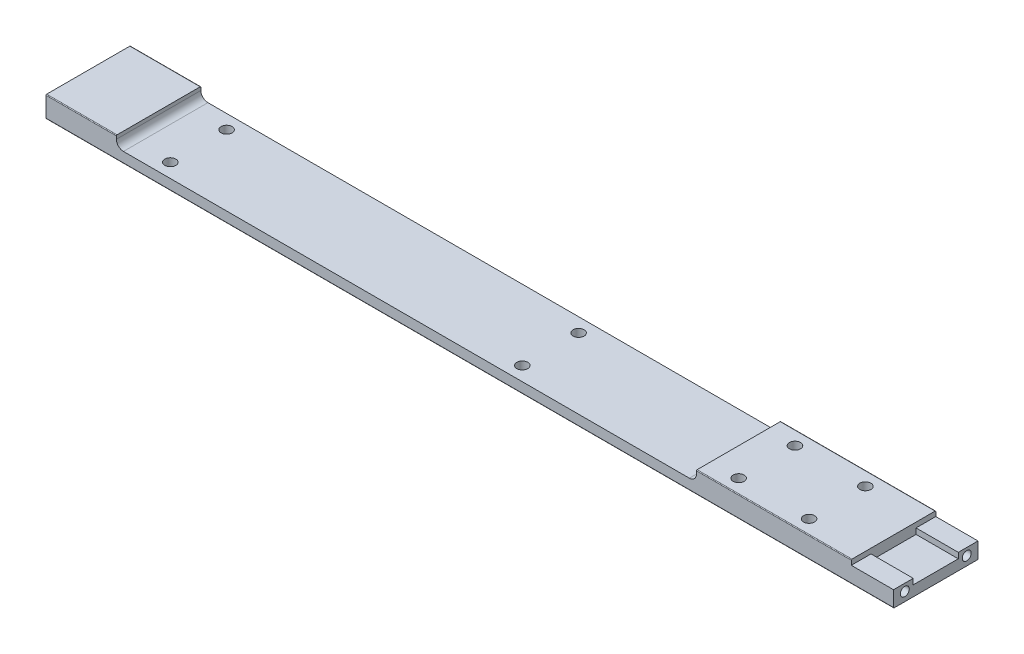
from build123d import *

# Parameters (mm, degrees)
BOSS_EXTRUDE1_DEPTH              = 4.7625
BOSS_EXTRUDE1_DEPTH_BACK         = 4.7625
SKETCH3_W                        = 382.27
SKETCH3_H                        = 38.1
FILLET1_R                        = 0.314325
TAP_DRILL_FOR_10_32_TAP1_D       = 4.0386
TAP_DRILL_FOR_10_32_TAP1_DEPTH   = 25.4
TAP_DRILL_FOR_10_32_TAP1_TIP     = 1.213317848
TAP_DRILL_FOR_10_32_TAP2_D       = 4.0386
TAP_DRILL_FOR_10_32_TAP2_DEPTH   = 25.4
TAP_DRILL_FOR_10_32_TAP2_TIP     = 1.213317848
SKETCH10_W                       = 19.05
SKETCH10_H                       = 2.286
CUT_EXTRUDE1_DEPTH               = 195.953531979
F_10_CLEARANCE_HOLE1_D           = 4.9784
F_10_CLEARANCE_HOLE1_CSINK_D     = 10.4394
F_10_CLEARANCE_HOLE1_CSINK_ANGLE = 82
CUT_EXTRUDE2_DEPTH               = 2.54
F_10_CLEARANCE_HOLE2_D           = 4.9784


with BuildPart() as part:
    # Sketch3 → Boss-Extrude1 (new, two sides: drawn at the far end of the back side and taken through both)
    with BuildSketch(Plane(origin=(0, 0, 0), x_dir=(1, 0, 0), z_dir=(0, 1, 0)).offset(-BOSS_EXTRUDE1_DEPTH_BACK)):
        Rectangle(SKETCH3_W, SKETCH3_H)
    extrude(amount=BOSS_EXTRUDE1_DEPTH + BOSS_EXTRUDE1_DEPTH_BACK)

    # Fillet1
    fillet1_edges = [part.edges().sort_by_distance(p)[0] for p in [
        (0, 4.7625, 19.05),
        (0, -4.7625, -19.05),
        (0, 4.7625, -19.05),
        (0, -4.7625, 19.05),
    ]]
    fillet(fillet1_edges, radius=FILLET1_R)

    # Tap Drill for #10-32 Tap1
    with Locations(Plane.ZY.offset(191.135)):
        with Locations((-13.97, -0.762), (13.97, -0.762)):
            Hole(TAP_DRILL_FOR_10_32_TAP1_D / 2, depth=TAP_DRILL_FOR_10_32_TAP1_DEPTH)
            with Locations((0, 0, -(TAP_DRILL_FOR_10_32_TAP1_DEPTH + TAP_DRILL_FOR_10_32_TAP1_TIP / 2))):  # 118° drill point
                Cone(0, TAP_DRILL_FOR_10_32_TAP1_D / 2, TAP_DRILL_FOR_10_32_TAP1_TIP, mode=Mode.SUBTRACT)

    # Tap Drill for #10-32 Tap2
    with Locations(Plane(origin=(191.135, 0, 0), x_dir=(0, 0, -1), z_dir=(1, 0, 0))):
        with Locations((-13.97, -0.762), (13.97, -0.762)):
            Hole(TAP_DRILL_FOR_10_32_TAP2_D / 2, depth=TAP_DRILL_FOR_10_32_TAP2_DEPTH)
            with Locations((0, 0, -(TAP_DRILL_FOR_10_32_TAP2_DEPTH + TAP_DRILL_FOR_10_32_TAP2_TIP / 2))):  # 118° drill point
                Cone(0, TAP_DRILL_FOR_10_32_TAP2_D / 2, TAP_DRILL_FOR_10_32_TAP2_TIP, mode=Mode.SUBTRACT)

    # Sketch10 → Cut-Extrude1 (cut, through all)
    with BuildSketch(Plane(origin=(0, 0, -19.05), x_dir=(-1, 0, 0), z_dir=(0, 0, -1))):
        with BuildLine():
            Line((159.385, 4.7625), (159.385, 3.175))
            ThreePointArc((159.385, 3.175), (158.45506403, 0.92993597), (156.21, 0))
            Line((156.21, 0), (-99.06, 0))
            ThreePointArc((-99.06, 0), (-101.30506403, 0.92993597), (-102.235, 3.175))
            Line((-102.235, 3.175), (-102.235, 4.7625))
            Line((-102.235, 4.7625), (159.385, 4.7625))
        make_face()
        with Locations((-181.61, 3.6195)):
            Rectangle(SKETCH10_W, SKETCH10_H)
    extrude(amount=-CUT_EXTRUDE1_DEPTH, mode=Mode.SUBTRACT)

    # #10 Clearance Hole1 (through all)
    with Locations(Plane(origin=(0, -4.7625, 0), x_dir=(-1, 0, 0), z_dir=(0, -1, 0))):
        with Locations((-114.935, 12.7), (-146.685, 12.7), (-146.685, -12.7), (-114.935, -12.7)):
            CounterSinkHole(F_10_CLEARANCE_HOLE1_D / 2, F_10_CLEARANCE_HOLE1_CSINK_D / 2, counter_sink_angle=F_10_CLEARANCE_HOLE1_CSINK_ANGLE)

    # Sketch17 → Cut-Extrude2 (cut)
    with BuildSketch(Plane(origin=(0, 2.4765, 0), x_dir=(1, 0, 0), z_dir=(0, 1, 0))):
        Polygon((191.135, 0), (191.135, 10.16), (172.085, 10.16), (172.085, -10.16), (191.135, -10.16), align=None)
    extrude(amount=-CUT_EXTRUDE2_DEPTH, mode=Mode.SUBTRACT)

    # #10 Clearance Hole2 (through all)
    with Locations(Plane(origin=(0, 0, 0), x_dir=(1, 0, 0), z_dir=(0, 1, 0))):
        with Locations((-141.418780002, 12.7), (-141.418780002, -12.7), (17.331219998, 12.7), (17.331219998, -12.7)):
            Hole(F_10_CLEARANCE_HOLE2_D / 2)


solid = part.part
